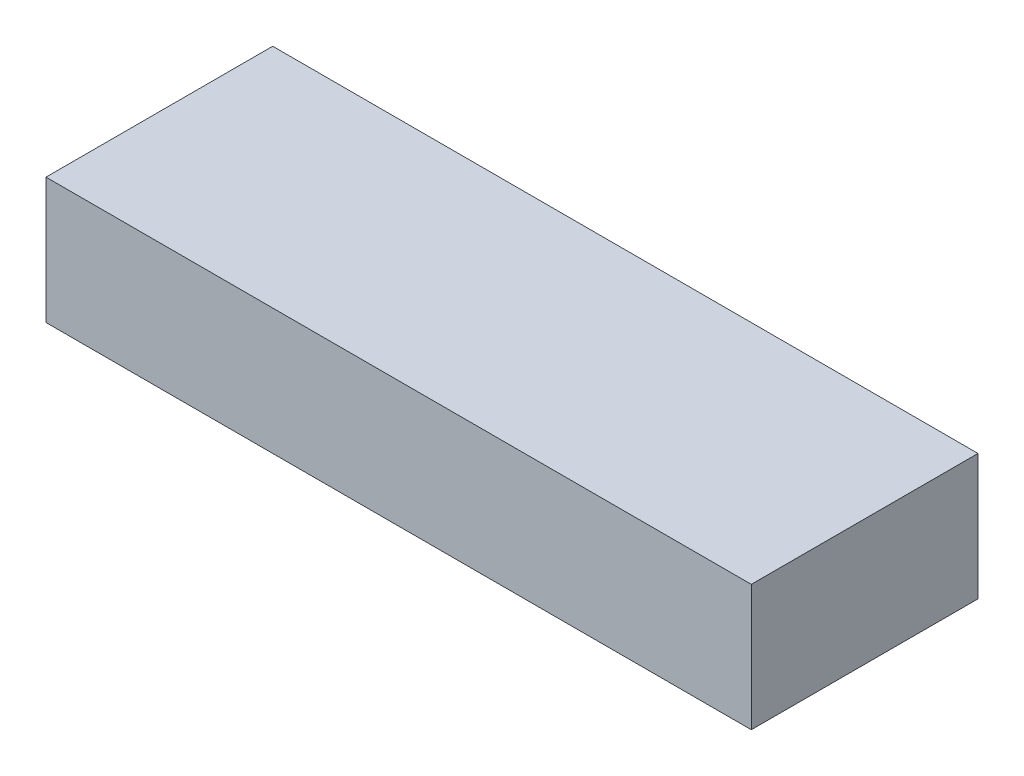
from build123d import *

# Parameters (mm, degrees)
ESBO_O1_W                = 140
ESBO_O1_H                = 45
RESSALTO_EXTRUS_O1_DEPTH = 25


with BuildPart() as part:
    # Esboço1 → Ressalto-extrusão1 (new body)
    with BuildSketch(Plane(origin=(0, 0, 0), x_dir=(1, 0, 0), z_dir=(0, 1, 0))):
        Rectangle(ESBO_O1_W, ESBO_O1_H)
    extrude(amount=RESSALTO_EXTRUS_O1_DEPTH)


solid = part.part
